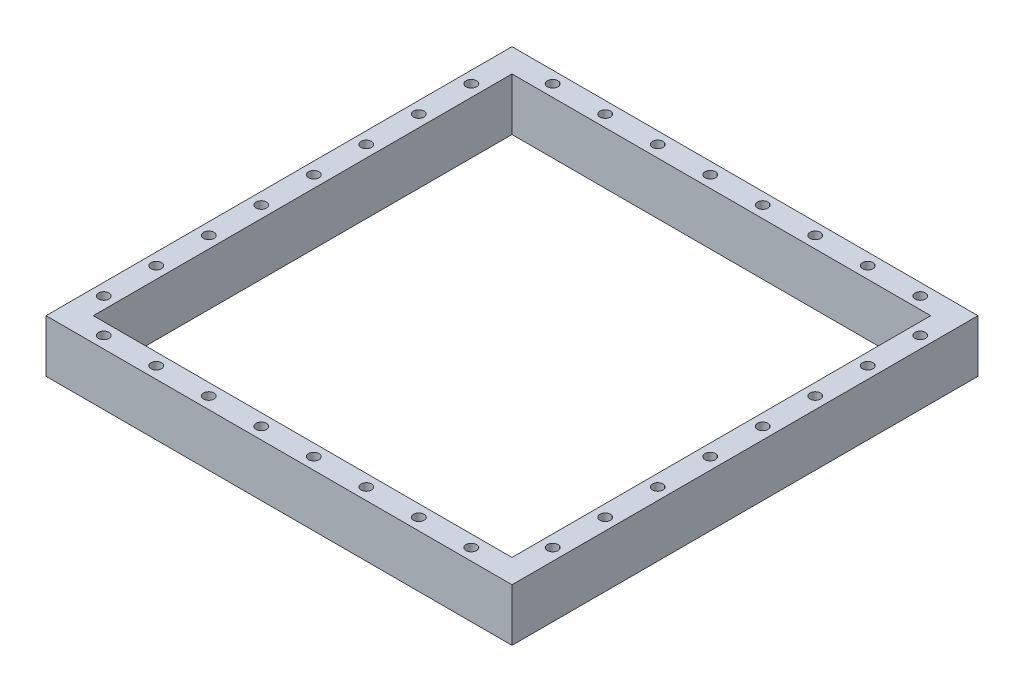
from build123d import *

# Parameters (mm, degrees)
SKETCH1_W                       = 225.425
SKETCH1_H                       = 225.425
SKETCH1_W_2                     = 202.565
SKETCH1_H_2                     = 202.565
BOSS_EXTRUDE1_DEPTH             = 25.4
TAP_DRILL_FOR_1_4_20_TAP1_D     = 5.1054
TAP_DRILL_FOR_1_4_20_TAP1_DEPTH = 12.7
TAP_DRILL_FOR_1_4_20_TAP1_TIP   = 1.533816902


with BuildPart() as part:
    # Sketch1 → Boss-Extrude1 (new body)
    with BuildSketch(Plane(origin=(0, 0, 0), x_dir=(1, 0, 0), z_dir=(0, 1, 0))):
        with Locations((112.7125, -112.7125)):
            Rectangle(SKETCH1_W, SKETCH1_H)
        with Locations((112.7125, -112.7125)):
            Rectangle(SKETCH1_W_2, SKETCH1_H_2, mode=Mode.SUBTRACT)
    extrude(amount=BOSS_EXTRUDE1_DEPTH)

    # Tap Drill for 1/4-20 Tap1
    with Locations(Plane(origin=(0, 25.4, 0), x_dir=(1, 0, 0), z_dir=(0, 1, 0))):
        with Locations((25.4, -5.715), (50.8, -5.715), (76.2, -5.715), (101.6, -5.715), (127, -5.715), (152.4, -5.715), (177.8, -5.715), (203.2, -5.715), (5.715, -25.4), (5.715, -50.8), (5.715, -76.2), (5.715, -101.6), (5.715, -127), (5.715, -152.4), (5.715, -177.8), (5.715, -203.2), (219.71, -22.225), (219.71, -47.625), (219.71, -73.025), (219.71, -98.425), (219.71, -123.825), (219.71, -149.225), (219.71, -174.625), (219.71, -200.025), (22.225, -219.71), (47.625, -219.71), (73.025, -219.71), (98.425, -219.71), (123.825, -219.71), (149.225, -219.71), (174.625, -219.71), (200.025, -219.71)):
            Hole(TAP_DRILL_FOR_1_4_20_TAP1_D / 2, depth=TAP_DRILL_FOR_1_4_20_TAP1_DEPTH)
            with Locations((0, 0, -(TAP_DRILL_FOR_1_4_20_TAP1_DEPTH + TAP_DRILL_FOR_1_4_20_TAP1_TIP / 2))):  # 118° drill point
                Cone(0, TAP_DRILL_FOR_1_4_20_TAP1_D / 2, TAP_DRILL_FOR_1_4_20_TAP1_TIP, mode=Mode.SUBTRACT)


solid = part.part
